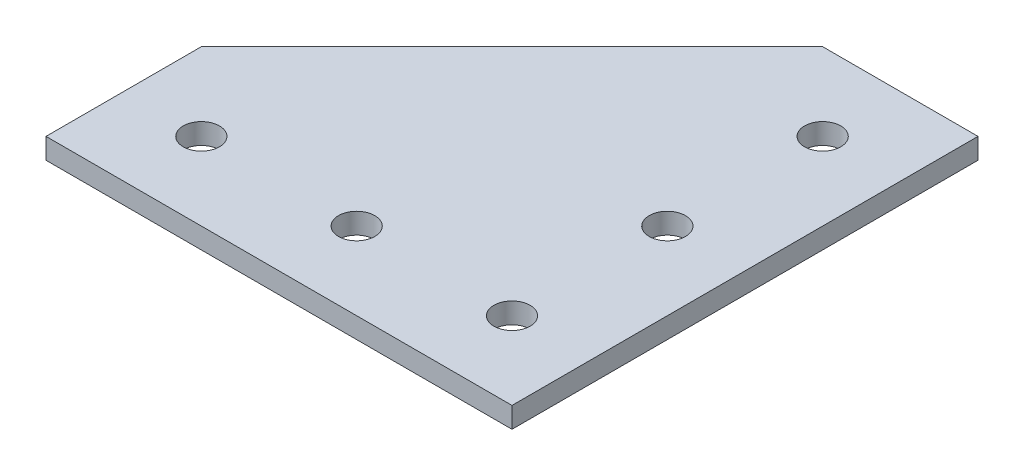
from build123d import *

# Parameters (mm, degrees)
BOSS_EXTRUDE1_DEPTH  = 4
M6_CLEARANCE_HOLE1_D = 7


with BuildPart() as part:
    # Sketch1 → Boss-Extrude1 (new body)
    with BuildSketch(Plane(origin=(0, 0, 0), x_dir=(1, 0, 0), z_dir=(0, 1, 0))):
        Polygon((0, 0), (-90, 0), (-90, 30), (-30, 90), (0, 90), align=None)
    extrude(amount=BOSS_EXTRUDE1_DEPTH)

    # M6 Clearance Hole1 (through all)
    with Locations(Plane(origin=(0, 4, 0), x_dir=(1, 0, 0), z_dir=(0, 1, 0))):
        with Locations((-75, 15), (-45, 15), (-15, 15), (-15, 45), (-15, 75)):
            Hole(M6_CLEARANCE_HOLE1_D / 2)


solid = part.part
